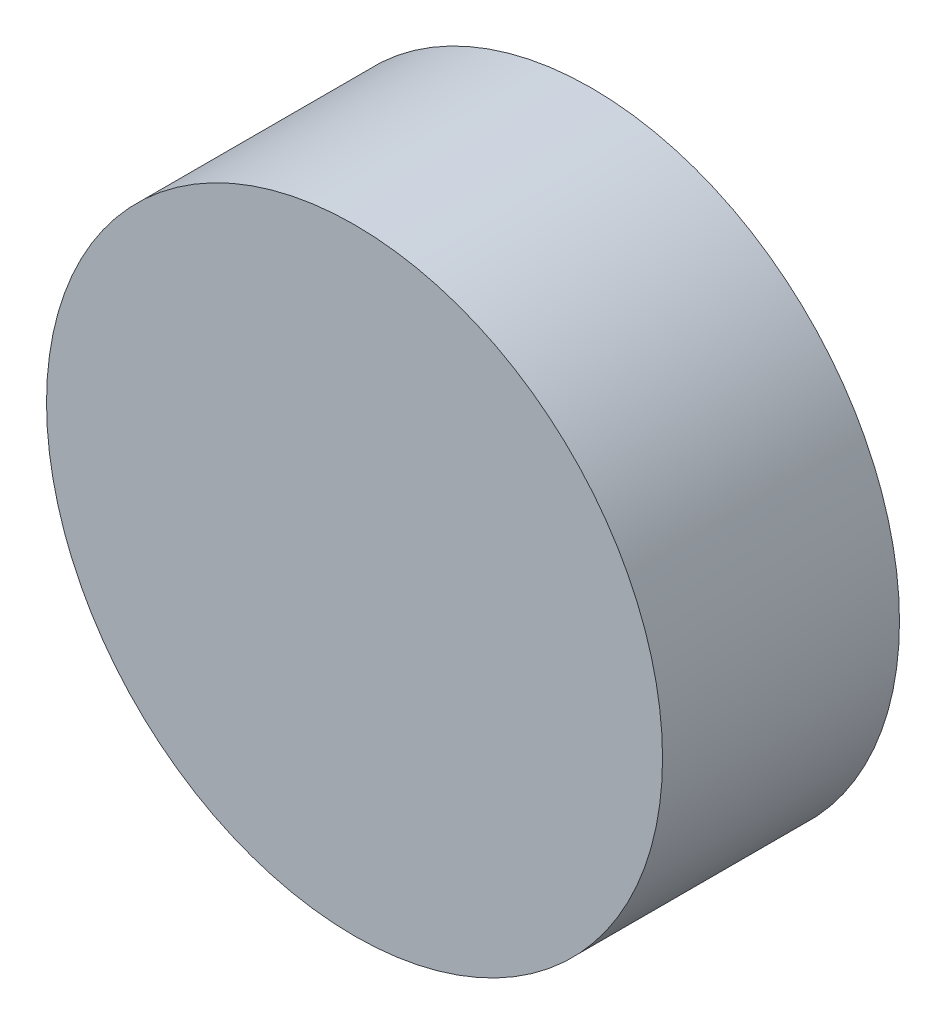
from build123d import *

# Parameters (mm, degrees)
SKETCH2_R           = 32.5
BOSS_EXTRUDE1_DEPTH = 25


with BuildPart() as part:
    # Sketch2 → Boss-Extrude1 (new body)
    with BuildSketch(Plane.XY):
        Circle(SKETCH2_R)
    extrude(amount=BOSS_EXTRUDE1_DEPTH)


solid = part.part
